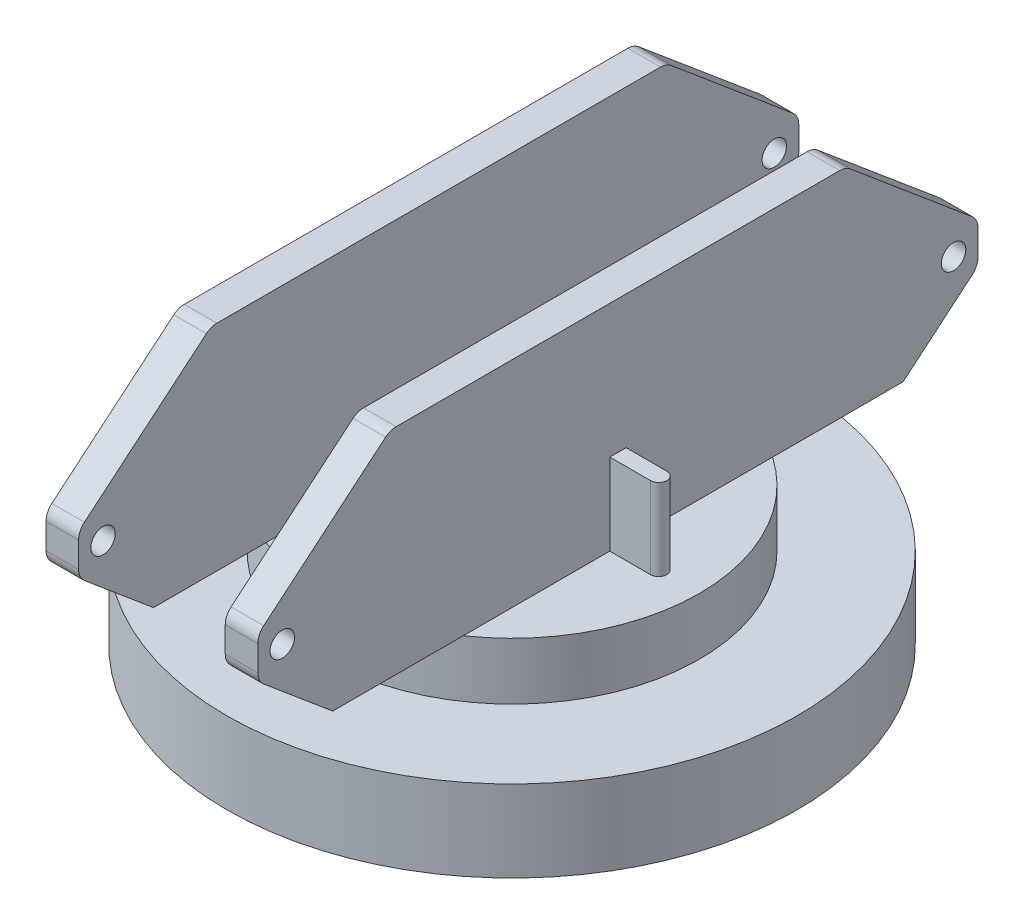
from build123d import *

# Parameters (mm, degrees)
SKETCH1_R                   = 35
BOSS_EXTRUDE1_DEPTH         = 10
SKETCH2_R                   = 23
BOSS_EXTRUDE2_DEPTH         = 7
BOSS_EXTRUDE3_DEPTH         = 4
SKETCH5_R                   = 1.5
CUT_EXTRUDE1_DEPTH          = 4
FILLET1_R                   = 2
FILLET1_OF_MIRROR1_R        = 2
SKETCH6_W                   = 6
SKETCH6_H                   = 2
BOSS_EXTRUDE4_DEPTH         = 10
FILLET2_RADIUS              = 1
FILLET2_LENGTH              = 10
FILLET2_OF_MIRROR2_2_RADIUS = 1
FILLET2_OF_MIRROR2_2_LENGTH = 10
SKETCH7_R                   = 15
CUT_EXTRUDE2_DEPTH          = 10


with BuildPart() as part:
    # Sketch1 → Boss-Extrude1 (new body)
    with BuildSketch(Plane(origin=(0, 0, 0), x_dir=(1, 0, 0), z_dir=(0, 1, 0))):
        with Locations(Location((0, 0, 0), (0, 0, 270))):
            Circle(SKETCH1_R)
    extrude(amount=BOSS_EXTRUDE1_DEPTH)

    # Sketch2 → Boss-Extrude2 (add)
    with BuildSketch(Plane(origin=(0, 10, 0), x_dir=(1, 0, 0), z_dir=(0, 1, 0))):
        with Locations(Location((0, 0, 0), (0, 0, 270))):
            Circle(SKETCH2_R)
    extrude(amount=BOSS_EXTRUDE2_DEPTH)

    # Sketch4 → Boss-Extrude3 (add)
    with BuildSketch(Plane(origin=(13, 0, 0), x_dir=(0, 0, -1), z_dir=(1, 0, 0))):
        Polygon((35, 17), (-35, 17), (-44.194, 24.714682009), (-44.194, 29.714682009), (-27.952, 43.343338219), (27.952, 43.343338219), (44.194, 29.714682009), (44.194, 24.714682009), align=None)
    boss_extrude3 = extrude(amount=-BOSS_EXTRUDE3_DEPTH)

    # Sketch5 → Cut-Extrude1 (cut)
    with BuildSketch(Plane(origin=(13, 0, 0), x_dir=(0, 0, -1), z_dir=(1, 0, 0))):
        with Locations((-41.194, 27.214682009)):
            Circle(SKETCH5_R)
        with Locations(Location((41.194, 27.214682009, 0), (0, 0, 180))):
            Circle(SKETCH5_R)
    cut_extrude1 = extrude(amount=-CUT_EXTRUDE1_DEPTH, mode=Mode.SUBTRACT)

    # Fillet1
    fillet1_edges = [part.edges().sort_by_distance(p)[0] for p in [
        (11, 43.343338219, 27.952),
        (11, 43.343338219, -27.952),
        (11, 29.714682009, -44.194),
        (11, 24.714682009, -44.194),
        (11, 24.714682009, 44.194),
        (11, 29.714682009, 44.194),
    ]]
    fillet(fillet1_edges, radius=FILLET1_R)

    # Mirror1: Boss-Extrude3, Cut-Extrude1 across plane
    add(boss_extrude3.mirror(Plane(origin=(0, 0, 0), x_dir=(0, 0, 1), z_dir=(1, 0, 0))))
    add(cut_extrude1.mirror(Plane(origin=(0, 0, 0), x_dir=(0, 0, 1), z_dir=(1, 0, 0))), mode=Mode.SUBTRACT)

    # Fillet1 of Mirror1
    fillet1_of_mirror1_edges = [part.edges().sort_by_distance(p)[0] for p in [
        (-11, 43.343338219, 27.952),
        (-11, 43.343338219, -27.952),
        (-11, 29.714682009, -44.194),
        (-11, 24.714682009, -44.194),
        (-11, 24.714682009, 44.194),
        (-11, 29.714682009, 44.194),
    ]]
    fillet(fillet1_of_mirror1_edges, radius=FILLET1_OF_MIRROR1_R)

    # Sketch6 → Boss-Extrude4 (add)
    with BuildSketch(Plane(origin=(0, 17, 0), x_dir=(1, 0, 0), z_dir=(0, 1, 0))):
        with Locations((-16, 0)):
            Rectangle(SKETCH6_W, SKETCH6_H)
    boss_extrude4 = extrude(amount=BOSS_EXTRUDE4_DEPTH)

    # Fillet2: full round fillet: the end face becomes a half cylinder, R = half its width
    fillet2_face = Plane((-19, 22, 0), x_dir=(0, -1, 0), z_dir=(-1, 0, 0))  # on the end face: x along it, z out of the body
    fillet2_slab = fillet2_face.offset(-FILLET2_RADIUS / 2) * Box(FILLET2_LENGTH, 2 * FILLET2_RADIUS, FILLET2_RADIUS, mode=Mode.PRIVATE)  # the body's end, R deep
    fillet2_round = Plane((-18, 22, 0), x_dir=(-1, 0, 0), z_dir=(0, -1, 0)) * Cylinder(FILLET2_RADIUS, FILLET2_LENGTH, mode=Mode.PRIVATE)  # its axis R under the face
    add(fillet2_slab - fillet2_round, mode=Mode.SUBTRACT)

    # Mirror2: Boss-Extrude4 across plane
    add(boss_extrude4.mirror(Plane(origin=(0, 0, 0), x_dir=(0, 0, 1), z_dir=(1, 0, 0))))

    # Fillet2 of Mirror2 2: full round fillet: the end face becomes a half cylinder, R = half its width
    fillet2_of_mirror2_2_face = Plane((19, 22, 0), x_dir=(0, -1, 0), z_dir=(1, 0, 0))  # on the end face: x along it, z out of the body
    fillet2_of_mirror2_2_slab = fillet2_of_mirror2_2_face.offset(-FILLET2_OF_MIRROR2_2_RADIUS / 2) * Box(FILLET2_OF_MIRROR2_2_LENGTH, 2 * FILLET2_OF_MIRROR2_2_RADIUS, FILLET2_OF_MIRROR2_2_RADIUS, mode=Mode.PRIVATE)  # the body's end, R deep
    fillet2_of_mirror2_2_round = Plane((18, 22, 0), x_dir=(1, 0, 0), z_dir=(0, -1, 0)) * Cylinder(FILLET2_OF_MIRROR2_2_RADIUS, FILLET2_OF_MIRROR2_2_LENGTH, mode=Mode.PRIVATE)  # its axis R under the face
    add(fillet2_of_mirror2_2_slab - fillet2_of_mirror2_2_round, mode=Mode.SUBTRACT)

    # Sketch7 → Cut-Extrude2 (cut)
    with BuildSketch(Plane.XZ):
        with Locations(Location((0, 0, 0), (0, 0, 270))):
            Circle(SKETCH7_R)
    extrude(amount=-CUT_EXTRUDE2_DEPTH, mode=Mode.SUBTRACT)


solid = part.part
